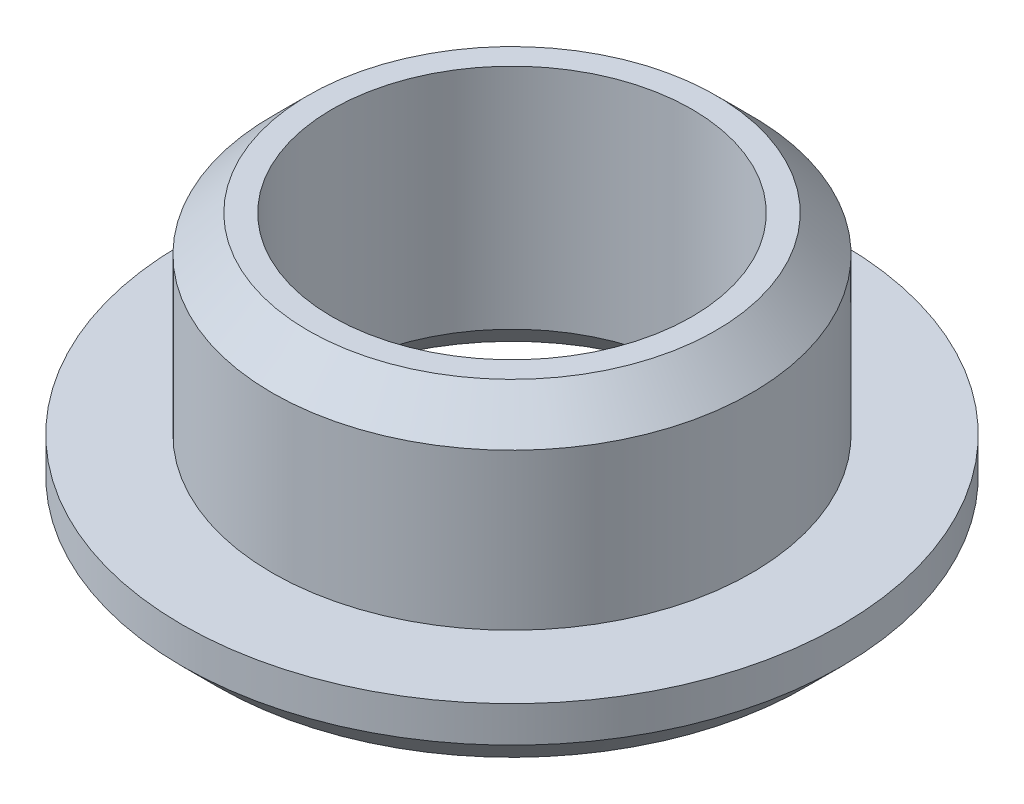
from build123d import *

# Parameters (mm, degrees)
SKETCH2_R           = 10
SKETCH2_R_2         = 7.5
BOSS_EXTRUDE1_DEPTH = 8
BOSS_EXTRUDE2_START = -3
SKETCH3_R           = 13.75
SKETCH3_R_2         = 10
SKETCH3_R_3         = 7.5
BOSS_EXTRUDE2_DEPTH = 3
CHAMFER1_SIZE       = 1.5


with BuildPart() as part:
    # Sketch2 → Boss-Extrude1 (new body)
    with BuildSketch(Plane(origin=(0, 0, 0), x_dir=(1, 0, 0), z_dir=(0, 1, 0))):
        with Locations(Location((0, 0, 0), (0, 0, 270))):
            Circle(SKETCH2_R)
        with Locations(Location((0, 0, 0), (0, 0, 270))):
            Circle(SKETCH2_R_2, mode=Mode.SUBTRACT)
    extrude(amount=BOSS_EXTRUDE1_DEPTH)

    # Sketch3 → Boss-Extrude2 (add)
    # profile 1 of 2: a face of its own
    with BuildSketch(Plane(origin=(0, 0, 0), x_dir=(1, 0, 0), z_dir=(0, 1, 0)).offset(BOSS_EXTRUDE2_START)):
        with Locations(Location((0, 0, 0), (0, 0, 270))):
            Circle(SKETCH3_R)
        with Locations(Location((0, 0, 0), (0, 0, 270))):
            Circle(SKETCH3_R_2, mode=Mode.SUBTRACT)
    # profile 2 of 2: a face of its own
    with BuildSketch(Plane(origin=(0, 0, 0), x_dir=(1, 0, 0), z_dir=(0, 1, 0)).offset(BOSS_EXTRUDE2_START)):
        with Locations(Location((0, 0, 0), (0, 0, 270))):
            Circle(SKETCH3_R_2)
        with Locations(Location((0, 0, 0), (0, 0, 270))):
            Circle(SKETCH3_R_3, mode=Mode.SUBTRACT)
    extrude(amount=BOSS_EXTRUDE2_DEPTH)

    # Chamfer1
    chamfer1_edges = [part.edges().sort_by_distance(p)[0] for p in [
        (0, -3, -13.75),
        (0, -3, -7.5),
        (0, 8, -10),
    ]]
    chamfer(chamfer1_edges, length=CHAMFER1_SIZE)


solid = part.part
